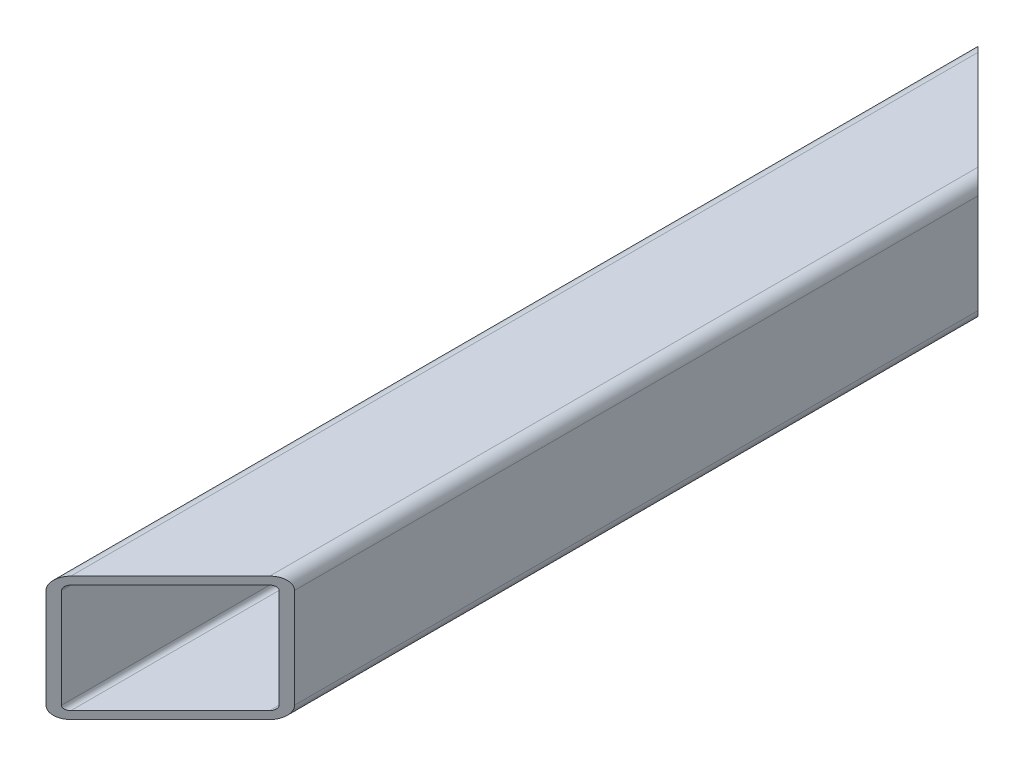
from build123d import *

# Parameters (mm, degrees)
DODANIE_WYCI_GNI_CIE1_DEPTH = 600
WYTNIJ_WYCI_GNI_CIE1_DEPTH  = 611.573500899


with BuildPart() as part:
    # Szkic1 → Dodanie-wyciągnięcie1 (new body)
    with BuildSketch(Plane.XY):
        with BuildLine():
            Line((8, 0), (72, 0))
            ThreePointArc((72, 0), (77.656854249, 2.343145751), (80, 8))
            Line((80, 8), (80, 72))
            ThreePointArc((80, 72), (77.656854249, 77.656854249), (72, 80))
            Line((72, 80), (8, 80))
            ThreePointArc((8, 80), (2.343145751, 77.656854249), (0, 72))
            Line((0, 72), (0, 8))
            ThreePointArc((0, 8), (2.343145751, 2.343145751), (8, 0))
        make_face()
        with BuildLine():
            Line((8, 75), (72, 75))
            ThreePointArc((72, 75), (74.121320344, 74.121320344), (75, 72))
            Line((75, 72), (75, 8))
            ThreePointArc((75, 8), (74.121320344, 5.878679656), (72, 5))
            Line((72, 5), (8, 5))
            ThreePointArc((8, 5), (5.878679656, 5.878679656), (5, 8))
            Line((5, 8), (5, 72))
            ThreePointArc((5, 72), (5.878679656, 74.121320344), (8, 75))
        make_face(mode=Mode.SUBTRACT)
    extrude(amount=-DODANIE_WYCI_GNI_CIE1_DEPTH)

    # Szkic2 → Wytnij-wyciągnięcie1 (cut, through all)
    with BuildSketch(Plane(origin=(0, 80, 0), x_dir=(1, 0, 0), z_dir=(0, 1, 0))):
        Polygon((0, 0), (80, 0), (80, 80), align=None)
        Polygon((80, 520), (0, 600), (80, 600), align=None)
    extrude(amount=-WYTNIJ_WYCI_GNI_CIE1_DEPTH, mode=Mode.SUBTRACT)


solid = part.part
